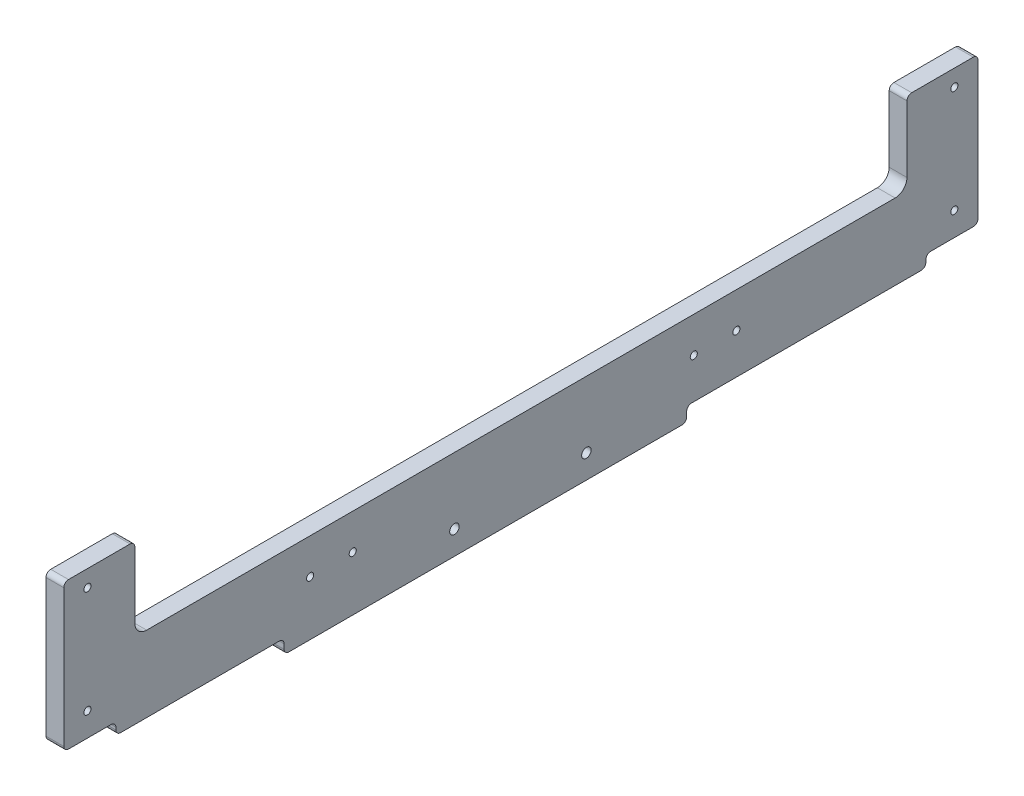
from build123d import *

# Parameters (mm, degrees)
EXTRUDE_1_DEPTH     = 7.5
SKETCH_2_R          = 2
CUT_EXTRUDE_1_DEPTH = 208.618038715
SKETCH_9_W          = 78
SKETCH_9_H          = 32
SKETCH_9_W_2        = 103
EXTRUDE_3_DEPTH     = 7.5
SKETCH_11_W         = 30
SKETCH_11_H         = 35
EXTRUDE_4_DEPTH     = 7.5
SKETCH_10_R         = 1.5
CUT_EXTRUDE_6_DEPTH = 316.292324677
FILLET_1_R          = 2
FILLET_3_R          = 5
SKETCH_12_W         = 22
SKETCH_12_H         = 5
CUT_EXTRUDE_7_DEPTH = 316.292324677
FILLET_4_R          = 2
SKETCH_13_R         = 1.5
CUT_EXTRUDE_8_DEPTH = 316.292324677


with BuildPart() as part:
    # 草图1 → 凸台-拉伸1 (new body)
    with BuildSketch(Plane(origin=(0, 0, 0), x_dir=(0, 0, -1), z_dir=(1, 0, 0))):
        Polygon((0, 32), (0, 0), (15, 0), (15, -6), (185, -6), (185, 0), (205, 0), (205, 32), align=None)
    extrude(amount=EXTRUDE_1_DEPTH)

    # 草图2 → 切除-拉伸1 (cut, through all)
    with BuildSketch(Plane(origin=(7.5, 0, 0), x_dir=(0, 0, -1), z_dir=(1, 0, 0))):
        with Locations((86.95, 4)):
            Circle(SKETCH_2_R)
        with Locations((142.65, 4)):
            Circle(SKETCH_2_R)
    extrude(amount=-CUT_EXTRUDE_1_DEPTH, mode=Mode.SUBTRACT)

    # 草图9 → 凸台-拉伸3 (add)
    with BuildSketch(Plane(origin=(7.5, 0, 0), x_dir=(0, 0, -1), z_dir=(1, 0, 0))):
        with Locations((-39, 16)):
            Rectangle(SKETCH_9_W, SKETCH_9_H)
        with Locations((256.5, 16)):
            Rectangle(SKETCH_9_W_2, SKETCH_9_H)
    extrude(amount=-EXTRUDE_3_DEPTH)

    # 草图11 → 凸台-拉伸4 (add)
    with BuildSketch(Plane(origin=(7.5, 0, 0), x_dir=(0, 0, -1), z_dir=(1, 0, 0))):
        with Locations((-63, 49.5)):
            Rectangle(SKETCH_11_W, SKETCH_11_H)
        with Locations((293, 49.5)):
            Rectangle(SKETCH_11_W, SKETCH_11_H)
    extrude(amount=-EXTRUDE_4_DEPTH)

    # 草图10 → 切除-拉伸6 (cut, through all)
    with BuildSketch(Plane(origin=(7.5, 0, 0), x_dir=(0, 0, -1), z_dir=(1, 0, 0))):
        with Locations((-68, 15)):
            Circle(SKETCH_10_R)
        with Locations((298, 15)):
            Circle(SKETCH_10_R)
        with Locations((-68, 60)):
            Circle(SKETCH_10_R)
        with Locations((298, 60)):
            Circle(SKETCH_10_R)
    extrude(amount=-CUT_EXTRUDE_6_DEPTH, mode=Mode.SUBTRACT)

    # 圆角1
    fillet_1_edges = [part.edges().sort_by_distance(p)[0] for p in [
        (3.75, 0, -185),
        (3.75, -6, -185),
        (3.75, -6, -15),
        (3.75, 0, -15),
        (3.75, 0, 78),
        (3.75, 0, -308),
        (3.75, 67, 78),
        (3.75, 67, 48),
        (3.75, 67, -308),
        (3.75, 67, -278),
    ]]
    fillet(fillet_1_edges, radius=FILLET_1_R)

    # 圆角3
    fillet_3_edges = [part.edges().sort_by_distance(p)[0] for p in [
        (3.75, 32, 48),
        (3.75, 32, -278),
    ]]
    fillet(fillet_3_edges, radius=FILLET_3_R)

    # 草图12 → 切除-拉伸7 (cut, through all)
    with BuildSketch(Plane(origin=(7.5, 0, 0), x_dir=(0, 0, -1), z_dir=(1, 0, 0))):
        with Locations((-67, 2.5)):
            Rectangle(SKETCH_12_W, SKETCH_12_H)
        with Locations((297, 2.5)):
            Rectangle(SKETCH_12_W, SKETCH_12_H)
    extrude(amount=-CUT_EXTRUDE_7_DEPTH, mode=Mode.SUBTRACT)

    # 圆角4
    fillet_4_edges = [part.edges().sort_by_distance(p)[0] for p in [
        (3.75, 5, 78),
        (3.75, 5, 56),
        (3.75, 0, 56),
        (3.75, 5, -308),
        (3.75, 0, -286),
        (3.75, 5, -286),
    ]]
    fillet(fillet_4_edges, radius=FILLET_4_R)

    # 草图13 → 切除-拉伸8 (cut, through all)
    with BuildSketch(Plane(origin=(7.5, 0, 0), x_dir=(0, 0, -1), z_dir=(1, 0, 0))):
        with Locations((205.999999668, 17.000000039)):
            Circle(SKETCH_13_R)
        with Locations((187.999999668, 17.000000039)):
            Circle(SKETCH_13_R)
        with Locations((43.999999668, 17.000000039)):
            Circle(SKETCH_13_R)
        with Locations((25.999999668, 17.000000039)):
            Circle(SKETCH_13_R)
    extrude(amount=-CUT_EXTRUDE_8_DEPTH, mode=Mode.SUBTRACT)


solid = part.part
